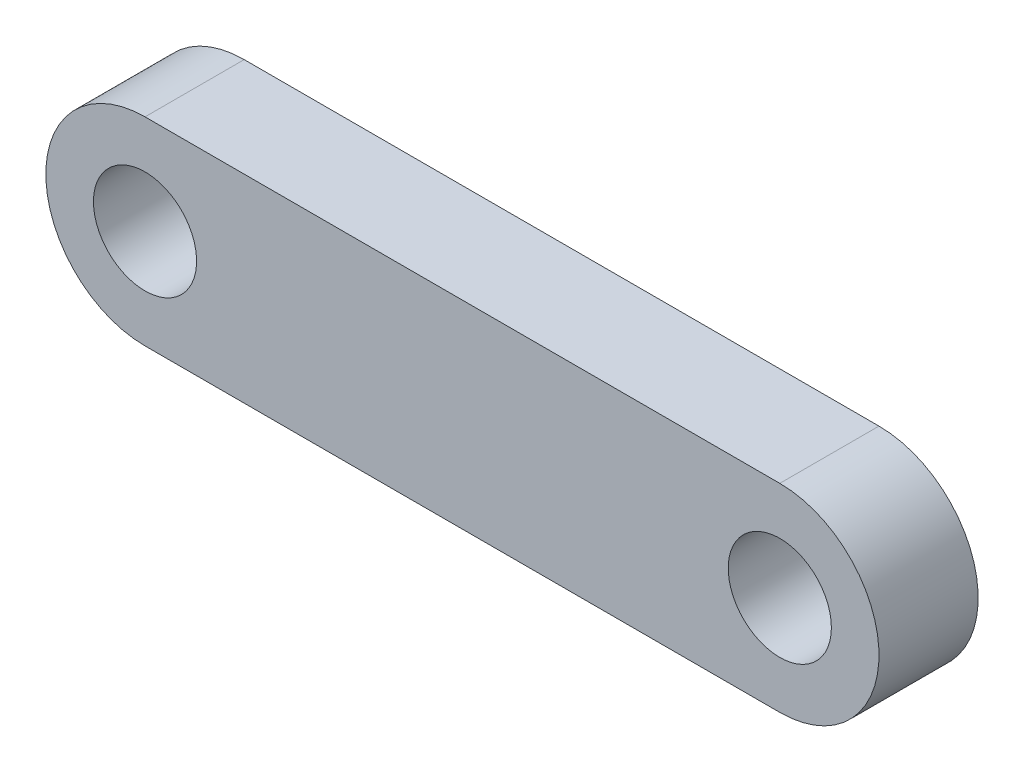
from build123d import *

# Parameters (mm, degrees)
SKETCH1_R           = 1.651
BOSS_EXTRUDE1_DEPTH = 3.175


with BuildPart() as part:
    # Sketch1 → Boss-Extrude1 (new body)
    with BuildSketch(Plane.XY):
        with BuildLine():
            Line((-71.178896696, 3.175), (-50.858896696, 3.175))
            ThreePointArc((-50.858896696, 3.175), (-47.683896696, 0), (-50.858896696, -3.175))
            Line((-50.858896696, -3.175), (-71.178896696, -3.175))
            ThreePointArc((-71.178896696, -3.175), (-74.353896696, 0), (-71.178896696, 3.175))
        make_face()
        with Locations((-50.858896696, 0)):
            Circle(SKETCH1_R, mode=Mode.SUBTRACT)
        with Locations(Location((-71.178896696, 0, 0), (0, 0, 180))):
            Circle(SKETCH1_R, mode=Mode.SUBTRACT)
    extrude(amount=BOSS_EXTRUDE1_DEPTH)


solid = part.part
